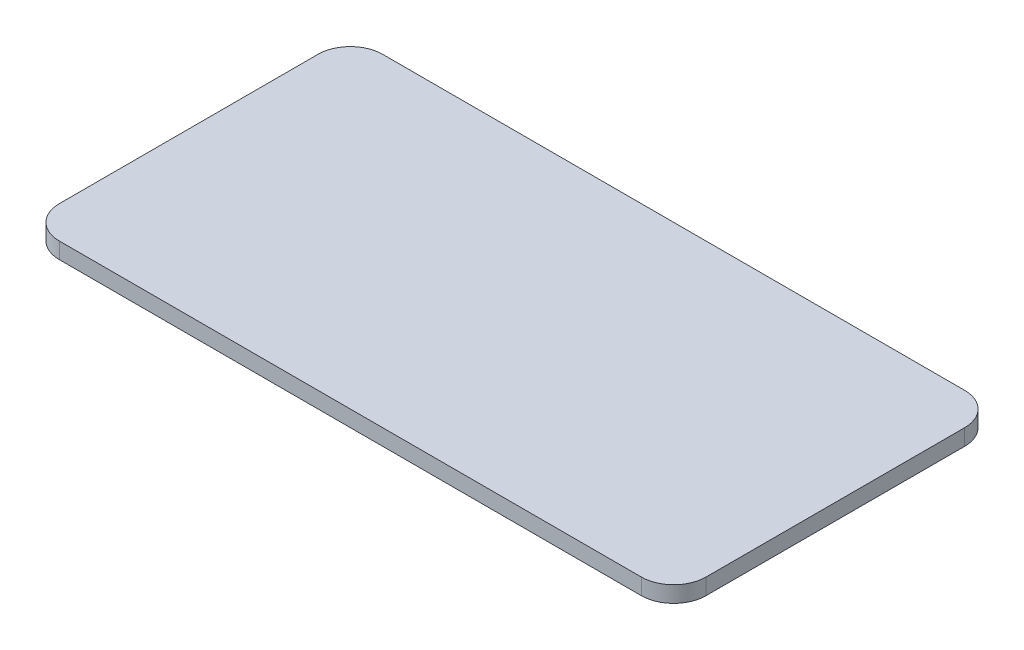
from build123d import *

# Parameters (mm, degrees)
SKETCH1_W           = 40
SKETCH1_H           = 20
BOSS_EXTRUDE1_DEPTH = 0.5
FILLET1_R           = 2


with BuildPart() as part:
    # Sketch1 → Boss-Extrude1 (new, symmetric)
    with BuildSketch(Plane(origin=(0, 0, 0), x_dir=(1, 0, 0), z_dir=(0, 1, 0))):
        Rectangle(SKETCH1_W, SKETCH1_H)
    extrude(amount=BOSS_EXTRUDE1_DEPTH, both=True)

    # Fillet1
    fillet1_edges = [part.edges().sort_by_distance(p)[0] for p in [
        (20, 0, 10),
        (-20, 0, 10),
        (-20, 0, -10),
        (20, 0, -10),
    ]]
    fillet(fillet1_edges, radius=FILLET1_R)


solid = part.part
